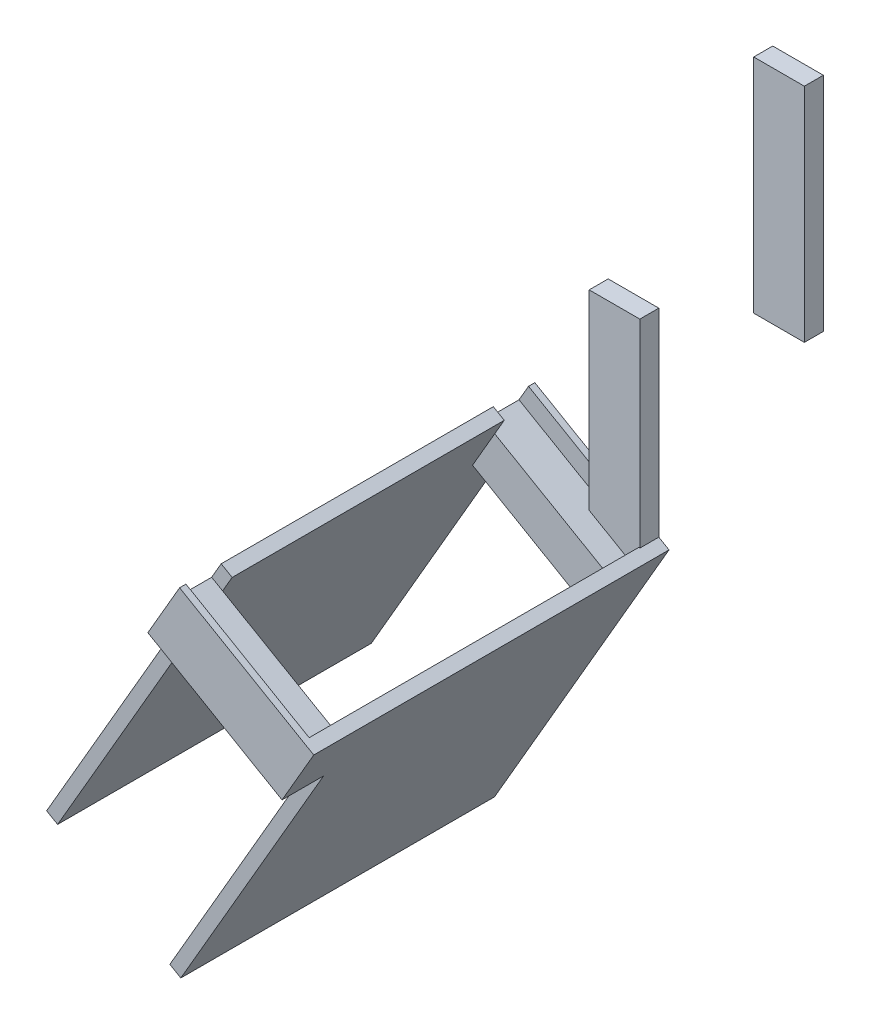
from build123d import *

# Parameters (mm, degrees)
SKETCH1_W           = 24.5
SKETCH1_H           = 56.133598892
SKETCH1_W_2         = 20.5
SKETCH1_H_2         = 43
BOSS_EXTRUDE1_DEPTH = 10
SKETCH16_W          = 49.566799446
SKETCH16_H          = 2
BOSS_EXTRUDE4_DEPTH = 45
SKETCH17_W          = 5.566799446
SKETCH17_H          = 991.145807274
CUT_EXTRUDE1_DEPTH  = 3
SKETCH18_W          = 8
SKETCH18_H          = 35.060194027
BOSS_EXTRUDE5_DEPTH = 3


with BuildPart() as part:
    # Sketch1 → Boss-Extrude1 (new body)
    with BuildSketch(Plane(origin=(0, 0, 0), x_dir=(-0.8652328616944664, 0.5013702175478758, -1.6721667044488096e-15), z_dir=(-0.5013702175478757, -0.8652328616944664, 2.9404411120007117e-15))):
        Rectangle(SKETCH1_W, SKETCH1_H)
        Rectangle(SKETCH1_W_2, SKETCH1_H_2, mode=Mode.SUBTRACT)
    extrude(amount=BOSS_EXTRUDE1_DEPTH)

    # Sketch16 → Boss-Extrude4 (add)
    with BuildSketch(Plane(origin=(-5.013702175, -8.652328617, 0), x_dir=(0, 0, -1), z_dir=(-0.5013702175478768, -0.8652328616944658, -1.9530974013437786e-15))):
        with Locations((3.283399723, 11.25)):
            Rectangle(SKETCH16_W, SKETCH16_H)
        with Locations((3.283399723, -11.25)):
            Rectangle(SKETCH16_W, SKETCH16_H)
    extrude(amount=BOSS_EXTRUDE4_DEPTH)

    # Sketch17 → Cut-Extrude1 (cut)
    with BuildSketch(Plane(origin=(0, 0, 0), x_dir=(0, 0, 1), z_dir=(0.5013702175478768, 0.8652328616944658, 1.9530974013437786e-15))):
        with Locations((-24.283399723, -485.322903637)):
            Rectangle(SKETCH17_W, SKETCH17_H)
        with Locations((24.283399723, -485.322903637)):
            Rectangle(SKETCH17_W, SKETCH17_H)
    extrude(amount=-CUT_EXTRUDE1_DEPTH, mode=Mode.SUBTRACT)

    # Sketch18 → Boss-Extrude5 (add)
    with BuildSketch(Plane(origin=(0, 0, -28.066799446), x_dir=(-1, 0, 0), z_dir=(0, 0, -1))):
        with Locations((-30.986297825, 53.474183751)):
            Rectangle(SKETCH18_W, SKETCH18_H)
        with Locations((-4.986297825, 8.60503593)):
            Rectangle(SKETCH18_W, SKETCH18_H)
    extrude(amount=-BOSS_EXTRUDE5_DEPTH)


with BuildPart() as boss_extrude5_piece_1:
    # of the separate pieces the step leaves, piece 1, a body of its own (boss_extrude5_pieces)
    add(part.part.solids().sort_by_distance((10.599102556, -6.141785165, -28.066799446))[0])


with BuildPart() as boss_extrude5_piece_2:
    # of the separate pieces the step leaves, piece 2, a body of its own (boss_extrude5_pieces)
    add(part.part.solids().sort_by_distance((34.986297825, 35.944086737, -28.066799446))[0])


solid = Compound([boss_extrude5_piece_1.part, boss_extrude5_piece_2.part])
